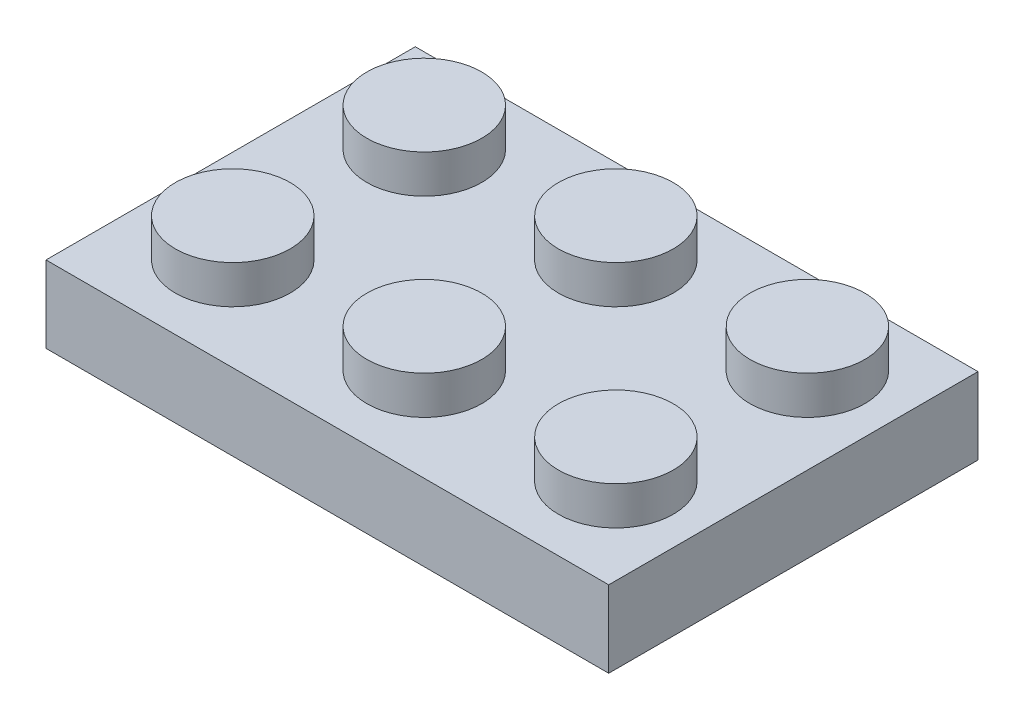
from build123d import *

# Parameters (mm, degrees)
SKETCH1_W            = 23.501694604
SKETCH1_H            = 3.2
BOSS_EXTRUDE1_DEPTH  = 15.423238167
SKETCH2_R            = 2.4
BOSS_EXTRUDE2_DEPTH  = 1.6
LPATTERN1_COUNT      = 2
LPATTERN1_PITCH      = 8
LPATTERN1_COUNT_DIR2 = 4
LPATTERN1_PITCH_DIR2 = 8
SHELL1_T             = -1.2
SKETCH4_R            = 3.25
SKETCH4_R_2          = 2.4
BOSS_EXTRUDE3_DEPTH  = 1.8
LPATTERN2_COUNT      = 2
LPATTERN2_PITCH      = 8


with BuildPart() as part:
    # Sketch1 → Boss-Extrude1 (new body)
    with BuildSketch(Plane.XY):
        with Locations((11.750847302, 1.6)):
            Rectangle(SKETCH1_W, SKETCH1_H)
    extrude(amount=-BOSS_EXTRUDE1_DEPTH)

    # Sketch2 → Boss-Extrude2 (add)
    with BuildSketch(Plane(origin=(0, 3.2, 0), x_dir=(1, 0, 0), z_dir=(0, 1, 0))):
        with Locations(Location((3.9, 3.9, 0), (0, 0, 270))):
            Circle(SKETCH2_R)
    boss_extrude2 = extrude(amount=BOSS_EXTRUDE2_DEPTH)

    # LPattern1: Boss-Extrude2 2 × 4, 2 skipped
    with Locations(*[(j * LPATTERN1_PITCH_DIR2, 0, -i * LPATTERN1_PITCH) for i in range(LPATTERN1_COUNT) for j in range(LPATTERN1_COUNT_DIR2) if (i, j) not in ((0, 0), (0, 3), (1, 3))]):
        add(boss_extrude2)

    # Shell1
    shell1_openings = [part.faces().sort_by_distance(p)[0] for p in [
        (11.750847302, 0, -7.711619084),
    ]]
    offset(amount=SHELL1_T, openings=shell1_openings, kind=Kind.INTERSECTION)

    # Sketch4 → Boss-Extrude3 (add)
    with BuildSketch(Plane.XZ.offset(-2)):
        with Locations(Location((7.9, -7.9, 0), (0, 0, 90))):
            Circle(SKETCH4_R)
        with Locations(Location((7.9, -7.9, 0), (0, 0, 270))):
            Circle(SKETCH4_R_2, mode=Mode.SUBTRACT)
    boss_extrude3 = extrude(amount=BOSS_EXTRUDE3_DEPTH)

    # LPattern2: Boss-Extrude3 ×2
    with Locations(*[(i * LPATTERN2_PITCH, 0, 0) for i in range(1, LPATTERN2_COUNT)]):
        add(boss_extrude3)


solid = part.part
